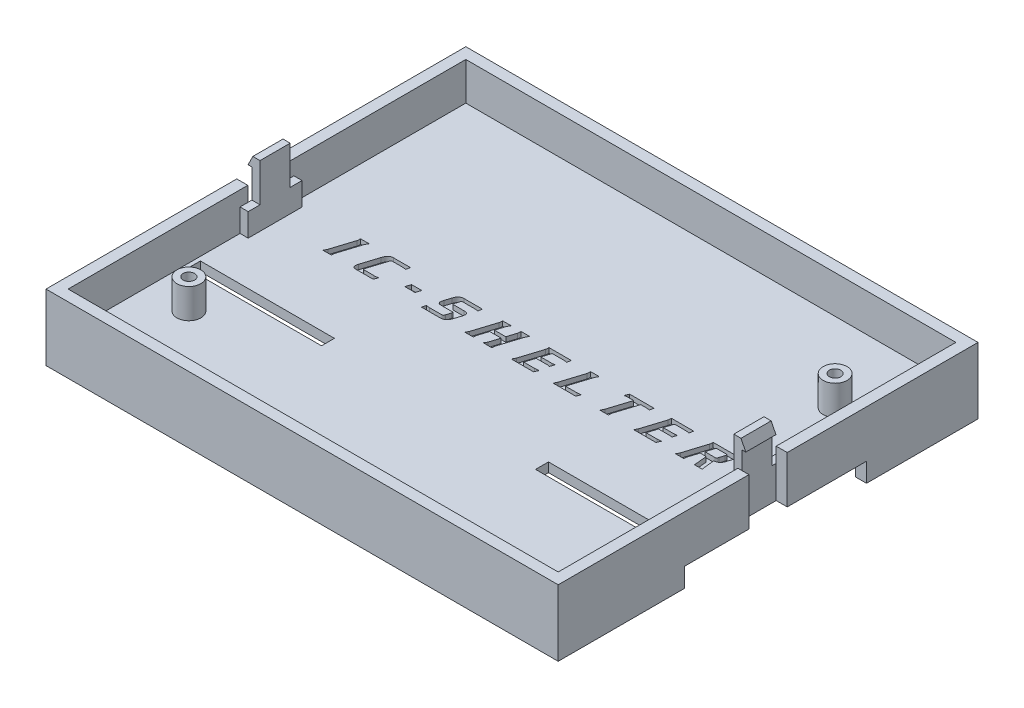
from build123d import *

# Parameters (mm, degrees)
SKETCH1_W           = 107
SKETCH1_H           = 87.7
BOSS_EXTRUDE1_DEPTH = 13.85
SKETCH2_W           = 102.38
SKETCH2_H           = 83.08
CUT_EXTRUDE1_DEPTH  = 7.9
CUT_EXTRUDE2_DEPTH  = 4
SKETCH4_R           = 2.5
SKETCH4_R_2         = 1.2
BOSS_EXTRUDE2_DEPTH = 6.2
SKETCH5_W           = 28
SKETCH5_H           = 2.7
CUT_EXTRUDE3_DEPTH  = 3.5
CHAMFER1_SIZE       = 2
SKETCH6_W           = 8
SKETCH6_H           = 9.85
CUT_EXTRUDE4_DEPTH  = 2.31
SKETCH7_W           = 11.25
SKETCH7_H           = 4.8
BOSS_EXTRUDE3_DEPTH = 1.7
BOSS_EXTRUDE4_DEPTH = 3.15
CUT_EXTRUDE5_DEPTH  = 1


with BuildPart() as part:
    # Sketch1 → Boss-Extrude1 (new body)
    with BuildSketch(Plane(origin=(0, 0, 0), x_dir=(1, 0, 0), z_dir=(0, 1, 0))):
        Rectangle(SKETCH1_W, SKETCH1_H)
    extrude(amount=BOSS_EXTRUDE1_DEPTH)

    # Sketch2 → Cut-Extrude1 (cut)
    with BuildSketch(Plane(origin=(0, 13.85, 0), x_dir=(1, 0, 0), z_dir=(0, 1, 0))):
        Rectangle(SKETCH2_W, SKETCH2_H)
    extrude(amount=-CUT_EXTRUDE1_DEPTH, mode=Mode.SUBTRACT)

    # Sketch3 → Cut-Extrude2 (cut)
    with BuildSketch(Plane.XZ):
        Polygon((-51.19, 41.54), (51.19, 41.54), (51.19, 19.24), (23.5, 19.24), (23.5, 14.74), (49.4, 14.74), (49.4, 17.44), (53.5, 17.44), (53.5, -20.56), (51.19, -20.56), (51.19, -41.54), (10.19, -41.54), (10.19, -22.86), (40.69, -22.86), (42.704360061, -23.54), (43.44, -21.360818071), (41.067741267, -20.56), (6.19, -20.56), (6.19, -43.85), (-6.19, -43.85), (-6.19, -20.56), (-41.067741267, -20.56), (-43.44, -21.360818071), (-42.704360061, -23.54), (-40.69, -22.86), (-10.19, -22.86), (-10.19, -41.54), (-51.19, -41.54), (-51.19, -20.56), (-53.5, -20.56), (-53.5, 17.44), (-49.4, 17.44), (-49.4, 14.74), (-23.5, 14.74), (-23.5, 19.24), (-51.19, 19.24), align=None)
    extrude(amount=-CUT_EXTRUDE2_DEPTH, mode=Mode.SUBTRACT)

    # Sketch4 → Boss-Extrude2 (add)
    # profile 1 of 2: a face of its own
    with BuildSketch(Plane(origin=(0, 5.95, 0), x_dir=(1, 0, 0), z_dir=(0, 1, 0))):
        with Locations(Location((-42.5, -25, 0), (0, 0, 90))):
            Circle(SKETCH4_R)
        with Locations(Location((-42.5, -25, 0), (0, 0, 90))):
            Circle(SKETCH4_R_2, mode=Mode.SUBTRACT)
    # profile 2 of 2: a face of its own
    with BuildSketch(Plane(origin=(0, 5.95, 0), x_dir=(1, 0, 0), z_dir=(0, 1, 0))):
        with Locations(Location((42.5, 25, 0), (0, 0, 90))):
            Circle(SKETCH4_R)
        with Locations(Location((42.5, 25, 0), (0, 0, 90))):
            Circle(SKETCH4_R_2, mode=Mode.SUBTRACT)
    extrude(amount=BOSS_EXTRUDE2_DEPTH)

    # Sketch5 → Cut-Extrude3 (cut)
    with BuildSketch(Plane(origin=(0, 5.95, 0), x_dir=(1, 0, 0), z_dir=(0, 1, 0))):
        with Locations((-36.36, -16.09)):
            Rectangle(SKETCH5_W, SKETCH5_H)
        with Locations((36.36, -16.09)):
            Rectangle(SKETCH5_W, SKETCH5_H)
    extrude(amount=-CUT_EXTRUDE3_DEPTH, mode=Mode.SUBTRACT)

    # Chamfer1
    chamfer1_edges = [part.edges().sort_by_distance(p)[0] for p in [
        (-36.45, 2.45, 14.74),
        (36.45, 2.45, 14.74),
    ]]
    chamfer(chamfer1_edges, length=CHAMFER1_SIZE)

    # Sketch6 → Cut-Extrude4 (cut)
    with BuildSketch(Plane.ZY.offset(53.5)):
        with Locations((0, 8.925)):
            Rectangle(SKETCH6_W, SKETCH6_H)
    cut_extrude4 = extrude(amount=-CUT_EXTRUDE4_DEPTH, mode=Mode.SUBTRACT)

    # Sketch7 → Boss-Extrude3 (add)
    with BuildSketch(Plane(origin=(-51.19, 0, 0), x_dir=(0, 0, -1), z_dir=(1, 0, 0))):
        with Locations((0, 8.35)):
            Rectangle(SKETCH7_W, SKETCH7_H)
    boss_extrude3 = extrude(amount=BOSS_EXTRUDE3_DEPTH)

    # Sketch8 → Boss-Extrude4 (add, symmetric)
    with BuildSketch(Plane.XY):
        Polygon((-49.49, 10.75), (-49.49, 18.75), (-50.99, 18.75), (-51.99, 16.75), (-51.19, 16.75), (-51.19, 10.75), align=None)
    boss_extrude4 = extrude(amount=BOSS_EXTRUDE4_DEPTH, both=True)

    # Mirror1: Cut-Extrude4, Boss-Extrude3, Boss-Extrude4 across plane
    add(cut_extrude4.mirror(Plane(origin=(0, 0, 0), x_dir=(0, 0, 1), z_dir=(1, 0, 0))), mode=Mode.SUBTRACT)
    add(boss_extrude3.mirror(Plane(origin=(0, 0, 0), x_dir=(0, 0, 1), z_dir=(1, 0, 0))))
    add(boss_extrude4.mirror(Plane(origin=(0, 0, 0), x_dir=(0, 0, 1), z_dir=(1, 0, 0))))

    # Sketch10 → Cut-Extrude5 (cut)
    # profile 1 of 10: a face of its own
    with BuildSketch(Plane(origin=(0, 5.95, 0), x_dir=(1, 0, 0), z_dir=(0, 1, 0))):
        with BuildLine():
            add(Edge.make_bspline(
                [(-39.534246575, 0), (-39.509795814, 0.037209919), (-39.46271729, 0.108855462), (-39.395757218, 0.212509289), (-39.336678414, 0.308856515), (-39.284749579, 0.39763134), (-39.241255689, 0.479564864), (-39.205047575, 0.55400485), (-39.176213237, 0.621279172), (-39.161172135, 0.664302044), (-39.154109589, 0.684503425)],
                knots=[0, 0, 0, 0, 1.361112175, 2.6207426, 3.772123349, 4.815841239, 5.764222117, 6.607051765, 7.34594142, 8, 8, 8, 8], degree=3))
            Line((-39.154109589, 0.684503425), (-37.695205479, 5.306506849))
            add(Edge.make_bspline(
                [(-37.695205479, 5.306506849), (-37.684812981, 5.346996191), (-37.661333088, 5.438474235), (-37.647026361, 5.596043727), (-37.637415303, 5.786677823), (-37.639914015, 5.92506192), (-37.641267123, 6)],
                knots=[0, 0, 0, 0, 0.717697452, 1.621502269, 2.711990341, 4, 4, 4, 4], degree=3))
            Line((-37.641267123, 6), (-35.833047945, 6))
            add(Edge.make_bspline(
                [(-35.833047945, 6), (-35.85819039, 5.962958883), (-35.906552837, 5.89170889), (-35.971257037, 5.785754972), (-36.030879011, 5.688715392), (-36.08219733, 5.598094002), (-36.127740943, 5.515718876), (-36.163113326, 5.43919409), (-36.193956021, 5.371312378), (-36.208799613, 5.327181122), (-36.215753425, 5.306506849)],
                knots=[0, 0, 0, 0, 1.352632945, 2.601840801, 3.75106252, 4.79402087, 5.74903223, 6.593863159, 7.341263777, 8, 8, 8, 8], degree=3))
            Line((-36.215753425, 5.306506849), (-37.674657534, 0.684503425))
            add(Edge.make_bspline(
                [(-37.674657534, 0.684503425), (-37.686431444, 0.639764155), (-37.711721987, 0.543663504), (-37.72862785, 0.383566481), (-37.735023482, 0.199906863), (-37.729147966, 0.069343843), (-37.726027397, 0)],
                knots=[0, 0, 0, 0, 0.80396994, 1.726940006, 2.792746096, 4, 4, 4, 4], degree=3))
            Line((-37.726027397, 0), (-39.534246575, 0))
        make_face()
    # profile 2 of 10: a face of its own
    with BuildSketch(Plane(origin=(0, 5.95, 0), x_dir=(1, 0, 0), z_dir=(0, 1, 0))):
        with BuildLine():
            Line((-29.025256849, 0), (-32.630136986, 0))
            add(Edge.make_bspline(
                [(-32.630136986, 0), (-32.669539062, 0.001182064), (-32.745136785, 0.00345), (-32.853443013, 0.015120285), (-32.950383931, 0.039071108), (-33.037998468, 0.068806023), (-33.113947323, 0.110744786), (-33.1813417, 0.159623296), (-33.236565983, 0.219241685), (-33.281529449, 0.287740893), (-33.314327573, 0.365339447), (-33.337808041, 0.451705306), (-33.349878402, 0.546693119), (-33.352521075, 0.650855293), (-33.342700639, 0.763417997), (-33.322820732, 0.885163537), (-33.293560845, 1.015649947), (-33.266838293, 1.104607036), (-33.252996575, 1.150684932)],
                knots=[0, 0, 0, 0, 1.160438921, 2.22644462, 3.198400038, 4.095238211, 4.941046152, 5.742509421, 6.53600764, 7.318928768, 8.14295912, 9.005038559, 9.946030151, 10.954470055, 12.066910316, 13.266443939, 14.584075639, 16, 16, 16, 16], degree=3))
            Line((-33.252996575, 1.150684932), (-32.112585616, 4.767123288))
            add(Edge.make_bspline(
                [(-32.112585616, 4.767123288), (-32.095882224, 4.816928468), (-32.063227934, 4.914295086), (-32.008358791, 5.054400118), (-31.947775929, 5.184730777), (-31.882485724, 5.305197072), (-31.812959665, 5.416583664), (-31.738696738, 5.517908339), (-31.659823277, 5.609900093), (-31.576596574, 5.692642836), (-31.487288342, 5.7643161), (-31.394800168, 5.828295052), (-31.296253592, 5.880796071), (-31.193728614, 5.924806998), (-31.086002242, 5.958059539), (-30.973973653, 5.982806466), (-30.856944021, 5.996758704), (-30.777432046, 5.998910214), (-30.737157534, 6)],
                knots=[0, 0, 0, 0, 1.263666205, 2.470403782, 3.617668027, 4.719039006, 5.764839928, 6.774153824, 7.738158615, 8.677590571, 9.592775031, 10.489698443, 11.379021679, 12.27422883, 13.169968966, 14.08706362, 15.031056908, 16, 16, 16, 16], degree=3))
            Line((-30.737157534, 6), (-27.214469178, 6))
            Line((-27.214469178, 6), (-27.380136986, 5.178082192))
            add(Edge.make_bspline(
                [(-27.380136986, 5.178082192), (-27.455391041, 5.190675541), (-27.60082953, 5.215013865), (-27.812505745, 5.240364025), (-28.00915213, 5.256962959), (-28.135244518, 5.259201754), (-28.195633562, 5.260273973)],
                knots=[0, 0, 0, 0, 1.115667961, 2.156177001, 3.116943454, 4, 4, 4, 4], degree=3))
            Line((-28.195633562, 5.260273973), (-30.268407534, 5.260273973))
            add(Edge.make_bspline(
                [(-30.268407534, 5.260273973), (-30.286478203, 5.259674641), (-30.320890821, 5.258533313), (-30.369251478, 5.246099051), (-30.412880099, 5.228890457), (-30.452497073, 5.199038482), (-30.48862335, 5.150706293), (-30.524825094, 5.080286767), (-30.562561149, 4.983829573), (-30.587259879, 4.910652972), (-30.601027397, 4.869863014)],
                knots=[0, 0, 0, 0, 0.772318714, 1.47075403, 2.128250998, 2.770214348, 3.566553132, 4.690802851, 6.155393796, 8, 8, 8, 8], degree=3))
            Line((-30.601027397, 4.869863014), (-31.77739726, 1.139126712))
            add(Edge.make_bspline(
                [(-31.77739726, 1.139126712), (-31.789292852, 1.098579968), (-31.810451097, 1.026460994), (-31.834154388, 0.929743077), (-31.842417813, 0.858218781), (-31.837520456, 0.805885682), (-31.81336452, 0.773869009), (-31.780872922, 0.753793901), (-31.739345211, 0.741096994), (-31.708150288, 0.740205871), (-31.69135274, 0.739726027)],
                knots=[0, 0, 0, 0, 2.001762492, 3.560459967, 4.700010057, 5.419755154, 5.971117409, 6.527670815, 7.207194075, 8, 8, 8, 8], degree=3))
            Line((-31.69135274, 0.739726027), (-29.536386986, 0.739726027))
            add(Edge.make_bspline(
                [(-29.536386986, 0.739726027), (-29.477712365, 0.740853684), (-29.351630086, 0.743276835), (-29.149051973, 0.760234195), (-28.919487357, 0.785748277), (-28.7576386, 0.809410498), (-28.672089041, 0.821917808)],
                knots=[0, 0, 0, 0, 0.810300329, 1.741204456, 2.806052241, 4, 4, 4, 4], degree=3))
            Line((-28.672089041, 0.821917808), (-29.025256849, 0))
        make_face()
    # profile 3 of 10: a face of its own
    with BuildSketch(Plane(origin=(0, 5.95, 0), x_dir=(1, 0, 0), z_dir=(0, 1, 0))):
        Polygon((-24.363441781, 1.97260274), (-24.026969178, 3.04109589), (-21.889982877, 3.04109589), (-22.226455479, 1.97260274), align=None)
    # profile 4 of 10: a face of its own
    with BuildSketch(Plane(origin=(0, 5.95, 0), x_dir=(1, 0, 0), z_dir=(0, 1, 0))):
        with BuildLine():
            Line((-18.895119863, 0), (-18.726883562, 0.821917808))
            add(Edge.make_bspline(
                [(-18.726883562, 0.821917808), (-18.65590844, 0.80937356), (-18.520296926, 0.785405379), (-18.324928604, 0.759857659), (-18.147550943, 0.743157914), (-18.035134368, 0.740827218), (-17.982020548, 0.739726027)],
                knots=[0, 0, 0, 0, 1.152572932, 2.202210539, 3.150592639, 4, 4, 4, 4], degree=3))
            Line((-17.982020548, 0.739726027), (-15.386558219, 0.739726027))
            add(Edge.make_bspline(
                [(-15.386558219, 0.739726027), (-15.362108822, 0.740399552), (-15.317237704, 0.741635648), (-15.255442916, 0.751949689), (-15.204980136, 0.767548986), (-15.161577062, 0.793119386), (-15.127319026, 0.837743435), (-15.094647774, 0.901633125), (-15.059091257, 0.98762321), (-15.037579497, 1.053757499), (-15.025684932, 1.090325342)],
                knots=[0, 0, 0, 0, 1.043794748, 1.915639756, 2.667406171, 3.291575652, 4.031460114, 5.029729377, 6.357638801, 8, 8, 8, 8], degree=3))
            Line((-15.025684932, 1.090325342), (-14.723886986, 2.047089041))
            add(Edge.make_bspline(
                [(-14.723886986, 2.047089041), (-14.713150382, 2.081169604), (-14.693888221, 2.142312329), (-14.679650842, 2.22610367), (-14.670592067, 2.291505503), (-14.681059292, 2.326715872), (-14.685359589, 2.341181507)],
                knots=[0, 0, 0, 0, 1.420746252, 2.548910313, 3.403842305, 4, 4, 4, 4], degree=3))
            add(Edge.make_bspline(
                [(-14.685359589, 2.341181507), (-14.691870184, 2.347694633), (-14.707878927, 2.363709602), (-14.747171389, 2.375386984), (-14.799285326, 2.382577403), (-14.838971446, 2.383207251), (-14.86130137, 2.383561644)],
                knots=[0, 0, 0, 0, 0.587453577, 1.44447538, 2.562100062, 4, 4, 4, 4], degree=3))
            Line((-14.86130137, 2.383561644), (-17.165239726, 2.383561644))
            add(Edge.make_bspline(
                [(-17.165239726, 2.383561644), (-17.208095743, 2.384065919), (-17.289742082, 2.385026629), (-17.406010733, 2.398575256), (-17.510201337, 2.417513637), (-17.601551861, 2.448194565), (-17.681971557, 2.483800201), (-17.748549476, 2.531468678), (-17.804203672, 2.585620446), (-17.845871419, 2.65038464), (-17.87582116, 2.724465582), (-17.894460263, 2.808612156), (-17.903066432, 2.903486949), (-17.901110405, 3.00883743), (-17.889491685, 3.125312086), (-17.865060911, 3.251895523), (-17.833623606, 3.390302606), (-17.804591477, 3.484764534), (-17.789383562, 3.534246575)],
                knots=[0, 0, 0, 0, 1.231264695, 2.345720904, 3.361858989, 4.268668367, 5.111053861, 5.879336969, 6.610342008, 7.330597154, 8.075660282, 8.896646918, 9.799186964, 10.808445024, 11.921609346, 13.159988401, 14.512315241, 16, 16, 16, 16], degree=3))
            Line((-17.789383562, 3.534246575), (-17.374571918, 4.849315068))
            add(Edge.make_bspline(
                [(-17.374571918, 4.849315068), (-17.359336273, 4.896195258), (-17.329672909, 4.987469642), (-17.27601572, 5.117893252), (-17.219290425, 5.239863744), (-17.155208586, 5.35185049), (-17.089596669, 5.456427178), (-17.016472225, 5.550589524), (-16.940298059, 5.637152459), (-16.856833366, 5.713068752), (-16.770328718, 5.781524557), (-16.67768376, 5.83936497), (-16.58171826, 5.890414026), (-16.479077964, 5.929383712), (-16.372590391, 5.962627976), (-16.260413924, 5.983027872), (-16.144273969, 5.998677353), (-16.065126321, 5.999553775), (-16.024828767, 6)],
                knots=[0, 0, 0, 0, 1.23271821, 2.400067025, 3.525804209, 4.595113774, 5.625923682, 6.611225658, 7.574396419, 8.506586583, 9.429876173, 10.330083802, 11.235373083, 12.144202616, 13.072509279, 14.021827649, 14.992825339, 16, 16, 16, 16], degree=3))
            Line((-16.024828767, 6), (-12.173373288, 6))
            Line((-12.173373288, 6), (-12.339041096, 5.178082192))
            add(Edge.make_bspline(
                [(-12.339041096, 5.178082192), (-12.416442066, 5.190646145), (-12.564922036, 5.214747852), (-12.779134166, 5.240164208), (-12.97533167, 5.256939938), (-13.100141459, 5.259197253), (-13.159674658, 5.260273973)],
                knots=[0, 0, 0, 0, 1.139583505, 2.186087893, 3.134779492, 4, 4, 4, 4], degree=3))
            Line((-13.159674658, 5.260273973), (-15.593321918, 5.260273973))
            add(Edge.make_bspline(
                [(-15.593321918, 5.260273973), (-15.622425682, 5.258765765), (-15.676413969, 5.255967998), (-15.739894619, 5.221430681), (-15.77635815, 5.169035994), (-15.805084974, 5.105498393), (-15.839963484, 5.017656481), (-15.862153838, 4.9500672), (-15.874571918, 4.912243151)],
                knots=[0, 0, 0, 0, 1.064308934, 1.974322456, 2.525355511, 3.384367104, 4.536249735, 6, 6, 6, 6], degree=3))
            Line((-15.874571918, 4.912243151), (-16.123715753, 4.123715753))
            add(Edge.make_bspline(
                [(-16.123715753, 4.123715753), (-16.135310071, 4.086222291), (-16.155731101, 4.020185185), (-16.176664822, 3.93217679), (-16.187219253, 3.871298382), (-16.187749164, 3.827980096), (-16.167140109, 3.803957711), (-16.139689414, 3.790288352), (-16.10325038, 3.781549005), (-16.075827886, 3.781079451), (-16.060787671, 3.780821918)],
                knots=[0, 0, 0, 0, 2.132483802, 3.755936377, 4.883239367, 5.537674022, 5.984093235, 6.514548247, 7.185285142, 8, 8, 8, 8], degree=3))
            Line((-16.060787671, 3.780821918), (-13.765839041, 3.780821918))
            add(Edge.make_bspline(
                [(-13.765839041, 3.780821918), (-13.718706213, 3.780408295), (-13.628908657, 3.779620261), (-13.501402634, 3.764961766), (-13.38758688, 3.743297004), (-13.286687724, 3.715354215), (-13.200230059, 3.674819451), (-13.127667908, 3.625624348), (-13.066575197, 3.569306312), (-13.022383902, 3.501180452), (-12.989940355, 3.425048743), (-12.968416422, 3.339250656), (-12.957485521, 3.244345725), (-12.95622275, 3.139742865), (-12.967379638, 3.025948485), (-12.988404443, 2.902056106), (-13.019149948, 2.768638577), (-13.04654736, 2.677505229), (-13.060787671, 2.630136986)],
                knots=[0, 0, 0, 0, 1.312998334, 2.501526962, 3.570948481, 4.541255777, 5.411304083, 6.218804536, 6.978334224, 7.709693262, 8.463295282, 9.276505627, 10.165973433, 11.120600951, 12.186822599, 13.348086378, 14.621618852, 16, 16, 16, 16], degree=3))
            Line((-13.060787671, 2.630136986), (-13.526969178, 1.150684932))
            add(Edge.make_bspline(
                [(-13.526969178, 1.150684932), (-13.542881572, 1.104328344), (-13.574072816, 1.013460837), (-13.625804772, 0.882311241), (-13.685579773, 0.760670403), (-13.750606344, 0.648381176), (-13.820643347, 0.544312768), (-13.895623872, 0.448801515), (-13.979089152, 0.364714499), (-14.064387199, 0.286001904), (-14.158236612, 0.219994861), (-14.255469947, 0.15945757), (-14.360256487, 0.11209174), (-14.46849104, 0.069295601), (-14.58386734, 0.039669886), (-14.70378789, 0.015855112), (-14.829799501, 0.003508211), (-14.91521812, 0.001187097), (-14.95890411, 0)],
                knots=[0, 0, 0, 0, 1.183124788, 2.31914397, 3.400600469, 4.451660653, 5.449078368, 6.427089108, 7.377129525, 8.306544691, 9.224339904, 10.142367794, 11.066944623, 11.995842601, 12.948408755, 13.937440142, 14.945136667, 16, 16, 16, 16], degree=3))
            Line((-14.95890411, 0), (-18.895119863, 0))
        make_face()
    # profile 5 of 10: a face of its own
    with BuildSketch(Plane(origin=(0, 5.95, 0), x_dir=(1, 0, 0), z_dir=(0, 1, 0))):
        with BuildLine():
            add(Edge.make_bspline(
                [(-9.863013699, 0), (-9.838989846, 0.035924789), (-9.792789244, 0.105012243), (-9.727201334, 0.204857309), (-9.668933524, 0.297500173), (-9.619010167, 0.383269885), (-9.576306353, 0.462146345), (-9.540373853, 0.533484237), (-9.511465901, 0.597572221), (-9.497176866, 0.63859939), (-9.490582192, 0.657534247)],
                knots=[0, 0, 0, 0, 1.36891587, 2.632580886, 3.783870438, 4.83506786, 5.77548295, 6.624448533, 7.365155552, 8, 8, 8, 8], degree=3))
            Line((-9.490582192, 0.657534247), (-8.01369863, 5.342465753))
            add(Edge.make_bspline(
                [(-8.01369863, 5.342465753), (-8.004305271, 5.379981546), (-7.982865513, 5.465609005), (-7.96864356, 5.613968742), (-7.96456745, 5.79578823), (-7.968108972, 5.92808152), (-7.970034247, 6)],
                knots=[0, 0, 0, 0, 0.700843401, 1.599631376, 2.695089817, 4, 4, 4, 4], degree=3))
            Line((-7.970034247, 6), (-6.161815068, 6))
            add(Edge.make_bspline(
                [(-6.161815068, 6), (-6.185838921, 5.964075211), (-6.232039523, 5.894987757), (-6.297627433, 5.795142691), (-6.355895243, 5.702499827), (-6.4058186, 5.616730115), (-6.448522414, 5.537853655), (-6.484454915, 5.466515763), (-6.513362866, 5.402427779), (-6.527651901, 5.36140061), (-6.534246575, 5.342465753)],
                knots=[0, 0, 0, 0, 1.36891587, 2.632580886, 3.783870438, 4.83506786, 5.77548295, 6.624448533, 7.365155552, 8, 8, 8, 8], degree=3))
            Line((-6.534246575, 5.342465753), (-7.130136986, 3.452054795))
            Line((-7.130136986, 3.452054795), (-4.746575342, 3.452054795))
            Line((-4.746575342, 3.452054795), (-4.150684932, 5.342465753))
            add(Edge.make_bspline(
                [(-4.150684932, 5.342465753), (-4.140267981, 5.382948441), (-4.117275583, 5.472302236), (-4.103465657, 5.623838982), (-4.098319026, 5.802667351), (-4.103981559, 5.931081976), (-4.107020548, 6)],
                knots=[0, 0, 0, 0, 0.756848396, 1.670523411, 2.749808109, 4, 4, 4, 4], degree=3))
            Line((-4.107020548, 6), (-2.29880137, 6))
            add(Edge.make_bspline(
                [(-2.29880137, 6), (-2.322825223, 5.964075211), (-2.369025824, 5.894987757), (-2.434613735, 5.795142691), (-2.492881544, 5.702499827), (-2.542804902, 5.616730115), (-2.585508715, 5.537853655), (-2.621441216, 5.466515763), (-2.650349168, 5.402427779), (-2.664638202, 5.36140061), (-2.671232877, 5.342465753)],
                knots=[0, 0, 0, 0, 1.36891587, 2.632580886, 3.783870438, 4.83506786, 5.77548295, 6.624448533, 7.365155552, 8, 8, 8, 8], degree=3))
            Line((-2.671232877, 5.342465753), (-4.148116438, 0.657534247))
            add(Edge.make_bspline(
                [(-4.148116438, 0.657534247), (-4.158666681, 0.617924223), (-4.182091268, 0.529978522), (-4.193176495, 0.379018913), (-4.201179246, 0.199526879), (-4.195068088, 0.069788087), (-4.191780822, 0)],
                knots=[0, 0, 0, 0, 0.741759319, 1.646920118, 2.734249479, 4, 4, 4, 4], degree=3))
            Line((-4.191780822, 0), (-6, 0))
            add(Edge.make_bspline(
                [(-6, 0), (-5.975976147, 0.035924789), (-5.929775546, 0.105012243), (-5.864187635, 0.204857309), (-5.805919825, 0.297500173), (-5.755996468, 0.383269885), (-5.713292655, 0.462146345), (-5.677360154, 0.533484237), (-5.648452202, 0.597572221), (-5.634163168, 0.63859939), (-5.627568493, 0.657534247)],
                knots=[0, 0, 0, 0, 1.36891587, 2.632580886, 3.783870438, 4.83506786, 5.77548295, 6.624448533, 7.365155552, 8, 8, 8, 8], degree=3))
            Line((-5.627568493, 0.657534247), (-4.980308219, 2.712328767))
            Line((-4.980308219, 2.712328767), (-7.363869863, 2.712328767))
            Line((-7.363869863, 2.712328767), (-8.011130137, 0.657534247))
            add(Edge.make_bspline(
                [(-8.011130137, 0.657534247), (-8.022581555, 0.614516117), (-8.04712817, 0.522304873), (-8.060604019, 0.368011529), (-8.066738529, 0.191713304), (-8.058927696, 0.066341613), (-8.054794521, 0)],
                knots=[0, 0, 0, 0, 0.805148988, 1.72587208, 2.796623744, 4, 4, 4, 4], degree=3))
            Line((-8.054794521, 0), (-9.863013699, 0))
        make_face()
    # profile 6 of 10: a face of its own
    with BuildSketch(Plane(origin=(0, 5.95, 0), x_dir=(1, 0, 0), z_dir=(0, 1, 0))):
        with BuildLine():
            add(Edge.make_bspline(
                [(-0.164383562, 0), (-0.1399328, 0.037209919), (-0.092854276, 0.108855462), (-0.025894204, 0.212509289), (0.0331846, 0.308856515), (0.085113435, 0.39763134), (0.128607325, 0.479564864), (0.164815439, 0.55400485), (0.193649777, 0.621279172), (0.208690878, 0.664302044), (0.215753425, 0.684503425)],
                knots=[0, 0, 0, 0, 1.361112175, 2.6207426, 3.772123349, 4.815841239, 5.764222117, 6.607051765, 7.34594142, 8, 8, 8, 8], degree=3))
            Line((0.215753425, 0.684503425), (1.674657534, 5.306506849))
            add(Edge.make_bspline(
                [(1.674657534, 5.306506849), (1.685050032, 5.346996191), (1.708529925, 5.438474235), (1.722836653, 5.596043727), (1.732447711, 5.786677823), (1.729948999, 5.92506192), (1.72859589, 6)],
                knots=[0, 0, 0, 0, 0.717697452, 1.621502269, 2.711990341, 4, 4, 4, 4], degree=3))
            Line((1.72859589, 6), (6.401969178, 6))
            Line((6.401969178, 6), (6.23630137, 5.178082192))
            add(Edge.make_bspline(
                [(6.23630137, 5.178082192), (6.159758549, 5.190652216), (6.01257753, 5.214822595), (5.799218704, 5.240313649), (5.603002761, 5.256888738), (5.477768428, 5.259183243), (5.418236301, 5.260273973)],
                knots=[0, 0, 0, 0, 1.130756186, 2.17428422, 3.132117056, 4, 4, 4, 4], degree=3))
            Line((5.418236301, 5.260273973), (3.13869863, 5.260273973))
            Line((3.13869863, 5.260273973), (2.568493151, 3.452054795))
            Line((2.568493151, 3.452054795), (4.896832192, 3.452054795))
            add(Edge.make_bspline(
                [(4.896832192, 3.452054795), (4.933257523, 3.453246377), (5.014071211, 3.455890038), (5.14644881, 3.472936143), (5.3015403, 3.498469013), (5.411903163, 3.5217847), (5.470890411, 3.534246575)],
                knots=[0, 0, 0, 0, 0.75263783, 1.66981153, 2.754550207, 4, 4, 4, 4], degree=3))
            Line((5.470890411, 3.534246575), (5.185787671, 2.630136986))
            add(Edge.make_bspline(
                [(5.185787671, 2.630136986), (5.134101174, 2.642651967), (5.036295516, 2.666333896), (4.896955138, 2.691671613), (4.774388177, 2.708711313), (4.698246617, 2.711186301), (4.663099315, 2.712328767)],
                knots=[0, 0, 0, 0, 1.203260836, 2.276914129, 3.204615464, 4, 4, 4, 4], degree=3))
            Line((4.663099315, 2.712328767), (2.334760274, 2.712328767))
            Line((2.334760274, 2.712328767), (1.713184932, 0.739726027))
            Line((1.713184932, 0.739726027), (4.001712329, 0.739726027))
            add(Edge.make_bspline(
                [(4.001712329, 0.739726027), (4.057817614, 0.740889024), (4.180474645, 0.743431561), (4.38004063, 0.760436307), (4.610869855, 0.785981137), (4.774890831, 0.80943779), (4.862157534, 0.821917808)],
                knots=[0, 0, 0, 0, 0.778335636, 1.701592613, 2.777141559, 4, 4, 4, 4], degree=3))
            Line((4.862157534, 0.821917808), (4.508989726, 0))
            Line((4.508989726, 0), (-0.164383562, 0))
        make_face()
    # profile 7 of 10: a face of its own
    with BuildSketch(Plane(origin=(0, 5.95, 0), x_dir=(1, 0, 0), z_dir=(0, 1, 0))):
        with BuildLine():
            add(Edge.make_bspline(
                [(8.547945205, 0), (8.572395967, 0.037209919), (8.619474491, 0.108855462), (8.686434563, 0.212509289), (8.745513367, 0.308856515), (8.797442202, 0.39763134), (8.840936092, 0.479564864), (8.877144206, 0.55400485), (8.905978544, 0.621279172), (8.921019646, 0.664302044), (8.928082192, 0.684503425)],
                knots=[0, 0, 0, 0, 1.361112175, 2.6207426, 3.772123349, 4.815841239, 5.764222117, 6.607051765, 7.34594142, 8, 8, 8, 8], degree=3))
            Line((8.928082192, 0.684503425), (10.386986301, 5.306506849))
            add(Edge.make_bspline(
                [(10.386986301, 5.306506849), (10.3973788, 5.346996191), (10.420858692, 5.438474235), (10.43516542, 5.596043727), (10.444776478, 5.786677823), (10.442277766, 5.92506192), (10.440924658, 6)],
                knots=[0, 0, 0, 0, 0.717697452, 1.621502269, 2.711990341, 4, 4, 4, 4], degree=3))
            Line((10.440924658, 6), (12.249143836, 6))
            add(Edge.make_bspline(
                [(12.249143836, 6), (12.22419452, 5.962408133), (12.176259887, 5.890183614), (12.109018897, 5.784699074), (12.05045461, 5.686313754), (11.998710542, 5.595534005), (11.952791989, 5.512897069), (11.918108303, 5.435622308), (11.88692028, 5.367474273), (11.872097958, 5.323333051), (11.86515411, 5.30265411)],
                knots=[0, 0, 0, 0, 1.356555722, 2.606323977, 3.760794175, 4.798505079, 5.748711483, 6.600937866, 7.344578082, 8, 8, 8, 8], degree=3))
            Line((11.86515411, 5.30265411), (10.425513699, 0.739726027))
            Line((10.425513699, 0.739726027), (12.788527397, 0.739726027))
            add(Edge.make_bspline(
                [(12.788527397, 0.739726027), (12.84505981, 0.740898675), (12.968996712, 0.743469488), (13.170287128, 0.760333255), (13.403236083, 0.786071093), (13.568552975, 0.809453435), (13.656678082, 0.821917808)],
                knots=[0, 0, 0, 0, 0.777382216, 1.704267316, 2.776218899, 4, 4, 4, 4], degree=3))
            Line((13.656678082, 0.821917808), (13.303510274, 0))
            Line((13.303510274, 0), (8.547945205, 0))
        make_face()
    # profile 8 of 10: a face of its own
    with BuildSketch(Plane(origin=(0, 5.95, 0), x_dir=(1, 0, 0), z_dir=(0, 1, 0))):
        with BuildLine():
            add(Edge.make_bspline(
                [(18.328767123, 0), (18.353928694, 0.037029119), (18.40232793, 0.108256034), (18.466589289, 0.214056166), (18.526857108, 0.310259039), (18.577948711, 0.399961402), (18.621846821, 0.482721837), (18.659171858, 0.557260427), (18.688054878, 0.625146249), (18.703116278, 0.668159364), (18.710188356, 0.688356164)],
                knots=[0, 0, 0, 0, 1.361498811, 2.618894632, 3.764529244, 4.81432369, 5.757971532, 6.61400348, 7.349205597, 8, 8, 8, 8], degree=3))
            Line((18.710188356, 0.688356164), (20.15239726, 5.260273973))
            Line((20.15239726, 5.260273973), (19.058219178, 5.260273973))
            add(Edge.make_bspline(
                [(19.058219178, 5.260273973), (18.998259584, 5.259180246), (18.87217149, 5.256880264), (18.675087655, 5.240409126), (18.460898264, 5.214710576), (18.31327471, 5.190635389), (18.23630137, 5.178082192)],
                knots=[0, 0, 0, 0, 0.870069771, 1.829656148, 2.868347151, 4, 4, 4, 4], degree=3))
            Line((18.23630137, 5.178082192), (18.586900685, 6))
            Line((18.586900685, 6), (23.662243151, 6))
            Line((23.662243151, 6), (23.496575342, 5.178082192))
            add(Edge.make_bspline(
                [(23.496575342, 5.178082192), (23.417890456, 5.190656803), (23.26641941, 5.214863352), (23.046640014, 5.240342556), (22.844005121, 5.256904105), (22.714497075, 5.259186904), (22.652825342, 5.260273973)],
                knots=[0, 0, 0, 0, 1.126633211, 2.168806728, 3.12798574, 4, 4, 4, 4], degree=3))
            Line((22.652825342, 5.260273973), (21.631849315, 5.260273973))
            Line((21.631849315, 5.260273973), (20.189640411, 0.688356164))
            add(Edge.make_bspline(
                [(20.189640411, 0.688356164), (20.178867692, 0.646154222), (20.155066516, 0.552913516), (20.13818216, 0.394691354), (20.130708457, 0.207248347), (20.134794698, 0.072350661), (20.136986301, 0)],
                knots=[0, 0, 0, 0, 0.753275075, 1.664281201, 2.747266888, 4, 4, 4, 4], degree=3))
            Line((20.136986301, 0), (18.328767123, 0))
        make_face()
    # profile 9 of 10: a face of its own
    with BuildSketch(Plane(origin=(0, 5.95, 0), x_dir=(1, 0, 0), z_dir=(0, 1, 0))):
        with BuildLine():
            add(Edge.make_bspline(
                [(25.397260274, 0), (25.421711035, 0.037209919), (25.46878956, 0.108855462), (25.535749631, 0.212509289), (25.594828435, 0.308856515), (25.646757271, 0.39763134), (25.69025116, 0.479564864), (25.726459274, 0.55400485), (25.755293613, 0.621279172), (25.770334714, 0.664302044), (25.77739726, 0.684503425)],
                knots=[0, 0, 0, 0, 1.361112175, 2.6207426, 3.772123349, 4.815841239, 5.764222117, 6.607051765, 7.34594142, 8, 8, 8, 8], degree=3))
            Line((25.77739726, 0.684503425), (27.23630137, 5.306506849))
            add(Edge.make_bspline(
                [(27.23630137, 5.306506849), (27.246693868, 5.346996191), (27.270173761, 5.438474235), (27.284480489, 5.596043727), (27.294091546, 5.786677823), (27.291592834, 5.92506192), (27.290239726, 6)],
                knots=[0, 0, 0, 0, 0.717697452, 1.621502269, 2.711990341, 4, 4, 4, 4], degree=3))
            Line((27.290239726, 6), (31.963613014, 6))
            Line((31.963613014, 6), (31.797945205, 5.178082192))
            add(Edge.make_bspline(
                [(31.797945205, 5.178082192), (31.721402385, 5.190652216), (31.574221366, 5.214822595), (31.360862539, 5.240313649), (31.164646597, 5.256888738), (31.039412263, 5.259183243), (30.979880137, 5.260273973)],
                knots=[0, 0, 0, 0, 1.130756186, 2.17428422, 3.132117056, 4, 4, 4, 4], degree=3))
            Line((30.979880137, 5.260273973), (28.700342466, 5.260273973))
            Line((28.700342466, 5.260273973), (28.130136986, 3.452054795))
            Line((28.130136986, 3.452054795), (30.458476027, 3.452054795))
            add(Edge.make_bspline(
                [(30.458476027, 3.452054795), (30.494901359, 3.453246377), (30.575715047, 3.455890038), (30.708092646, 3.472936143), (30.863184136, 3.498469013), (30.973546999, 3.5217847), (31.032534247, 3.534246575)],
                knots=[0, 0, 0, 0, 0.75263783, 1.66981153, 2.754550207, 4, 4, 4, 4], degree=3))
            Line((31.032534247, 3.534246575), (30.747431507, 2.630136986))
            add(Edge.make_bspline(
                [(30.747431507, 2.630136986), (30.695745009, 2.642651967), (30.597939352, 2.666333896), (30.458598974, 2.691671613), (30.336032012, 2.708711313), (30.259890453, 2.711186301), (30.224743151, 2.712328767)],
                knots=[0, 0, 0, 0, 1.203260836, 2.276914129, 3.204615464, 4, 4, 4, 4], degree=3))
            Line((30.224743151, 2.712328767), (27.89640411, 2.712328767))
            Line((27.89640411, 2.712328767), (27.274828767, 0.739726027))
            Line((27.274828767, 0.739726027), (29.563356164, 0.739726027))
            add(Edge.make_bspline(
                [(29.563356164, 0.739726027), (29.619461449, 0.740889024), (29.742118481, 0.743431561), (29.941684466, 0.760436307), (30.172513691, 0.785981137), (30.336534667, 0.80943779), (30.42380137, 0.821917808)],
                knots=[0, 0, 0, 0, 0.778335636, 1.701592613, 2.777141559, 4, 4, 4, 4], degree=3))
            Line((30.42380137, 0.821917808), (30.070633562, 0))
            Line((30.070633562, 0), (25.397260274, 0))
        make_face()
    # profile 10 of 10: a face of its own
    with BuildSketch(Plane(origin=(0, 5.95, 0), x_dir=(1, 0, 0), z_dir=(0, 1, 0))):
        with BuildLine():
            add(Edge.make_bspline(
                [(34.109589041, 0), (34.134039803, 0.037209919), (34.181118327, 0.108855462), (34.248078399, 0.212509289), (34.307157202, 0.308856515), (34.359086038, 0.39763134), (34.402579927, 0.479564864), (34.438788041, 0.55400485), (34.46762238, 0.621279172), (34.482663481, 0.664302044), (34.489726027, 0.684503425)],
                knots=[0, 0, 0, 0, 1.361112175, 2.6207426, 3.772123349, 4.815841239, 5.764222117, 6.607051765, 7.34594142, 8, 8, 8, 8], degree=3))
            Line((34.489726027, 0.684503425), (35.948630137, 5.306506849))
            add(Edge.make_bspline(
                [(35.948630137, 5.306506849), (35.959022635, 5.346996191), (35.982502528, 5.438474235), (35.996809256, 5.596043727), (36.006420314, 5.786677823), (36.003921602, 5.92506192), (36.002568493, 6)],
                knots=[0, 0, 0, 0, 0.717697452, 1.621502269, 2.711990341, 4, 4, 4, 4], degree=3))
            Line((36.002568493, 6), (40.440924658, 6))
            add(Edge.make_bspline(
                [(40.440924658, 6), (40.48379287, 5.999609572), (40.565937455, 5.998861429), (40.683015757, 5.983639509), (40.789493597, 5.963453089), (40.883710644, 5.930201145), (40.968829166, 5.891623181), (41.040827757, 5.840108401), (41.104629747, 5.782771117), (41.152831508, 5.712833461), (41.19289146, 5.636032692), (41.218656493, 5.549223452), (41.235910899, 5.454075573), (41.240264207, 5.350106543), (41.233424581, 5.237026349), (41.214715918, 5.115682634), (41.186492996, 4.984705828), (41.159889058, 4.895806597), (41.145976027, 4.849315068)],
                knots=[0, 0, 0, 0, 1.216916336, 2.331869733, 3.350501688, 4.289078437, 5.165033108, 5.995110328, 6.795422034, 7.58867749, 8.393781525, 9.247842418, 10.14976185, 11.136221436, 12.196208763, 13.364239812, 14.621579545, 16, 16, 16, 16], degree=3))
            Line((41.145976027, 4.849315068), (40.835188356, 3.863013699))
            add(Edge.make_bspline(
                [(40.835188356, 3.863013699), (40.819049697, 3.815721416), (40.787295674, 3.722670301), (40.731139782, 3.589412579), (40.66742528, 3.465324097), (40.598989733, 3.349287461), (40.520918239, 3.243163679), (40.436218741, 3.146238518), (40.346399594, 3.05586892), (40.280111988, 3.004049814), (40.247003425, 2.978167808)],
                knots=[0, 0, 0, 0, 1.110179777, 2.184362016, 3.209626256, 4.208017536, 5.174541916, 6.132036676, 7.06701137, 8, 8, 8, 8], degree=3))
            add(Edge.make_bspline(
                [(40.247003425, 2.978167808), (40.191181892, 2.9421848), (40.075850228, 2.867841084), (39.874264381, 2.795312972), (39.649725396, 2.742499799), (39.490481531, 2.729440304), (39.407106164, 2.72260274)],
                knots=[0, 0, 0, 0, 0.893785719, 1.846631384, 2.872560039, 4, 4, 4, 4], degree=3))
            Line((39.407106164, 2.72260274), (39.633133562, 0.743578767))
            add(Edge.make_bspline(
                [(39.633133562, 0.743578767), (39.63589536, 0.708810047), (39.642004672, 0.631898941), (39.657844665, 0.556368659), (39.666523973, 0.514982877)],
                knots=[0, 0, 0, 0, 0.90412742, 2, 2, 2, 2], degree=3))
            add(Edge.make_bspline(
                [(39.666523973, 0.514982877), (39.673724805, 0.478580311), (39.688990328, 0.401408087), (39.714821206, 0.279428671), (39.744510441, 0.144185437), (39.765792696, 0.049647218), (39.776969178, 0)],
                knots=[0, 0, 0, 0, 0.845415984, 1.792253677, 2.840590983, 4, 4, 4, 4], degree=3))
            Line((39.776969178, 0), (38.121575342, 0))
            Line((38.121575342, 0), (37.867294521, 2.712328767))
            Line((37.867294521, 2.712328767), (36.608732877, 2.712328767))
            Line((36.608732877, 2.712328767), (35.970462329, 0.688356164))
            add(Edge.make_bspline(
                [(35.970462329, 0.688356164), (35.958655632, 0.64361863), (35.933186073, 0.547110246), (35.916918501, 0.386092954), (35.908289707, 0.201229188), (35.91450752, 0.069779505), (35.917808219, 0)],
                knots=[0, 0, 0, 0, 0.799459426, 1.724604164, 2.79211581, 4, 4, 4, 4], degree=3))
            Line((35.917808219, 0), (34.109589041, 0))
        make_face()
        with BuildLine():
            Line((36.842465753, 3.452054795), (38.933219178, 3.452054795))
            add(Edge.make_bspline(
                [(38.933219178, 3.452054795), (38.960698865, 3.452947475), (39.011794623, 3.454607327), (39.082849265, 3.468978314), (39.142819889, 3.491079657), (39.193580318, 3.525975968), (39.236630743, 3.578066753), (39.276289352, 3.649341773), (39.315894757, 3.741687598), (39.339168263, 3.81101209), (39.351883562, 3.848886986)],
                knots=[0, 0, 0, 0, 1.034725654, 1.923969891, 2.721034593, 3.428267314, 4.21761804, 5.244386576, 6.494492057, 8, 8, 8, 8], degree=3))
            Line((39.351883562, 3.848886986), (39.671660959, 4.863441781))
            add(Edge.make_bspline(
                [(39.671660959, 4.863441781), (39.683229888, 4.900900651), (39.703926808, 4.967914914), (39.72038919, 5.05978729), (39.727656075, 5.129980167), (39.717188695, 5.184293064), (39.686094867, 5.222071972), (39.638702477, 5.244453729), (39.57653289, 5.257972376), (39.529631924, 5.259448914), (39.503424658, 5.260273973)],
                knots=[0, 0, 0, 0, 1.674279576, 2.995301597, 3.985116824, 4.682024417, 5.293695265, 5.997775338, 6.881199261, 8, 8, 8, 8], degree=3))
            Line((39.503424658, 5.260273973), (37.412671233, 5.260273973))
            Line((37.412671233, 5.260273973), (36.842465753, 3.452054795))
        make_face(mode=Mode.SUBTRACT)
    extrude(amount=-CUT_EXTRUDE5_DEPTH, mode=Mode.SUBTRACT)


solid = part.part
